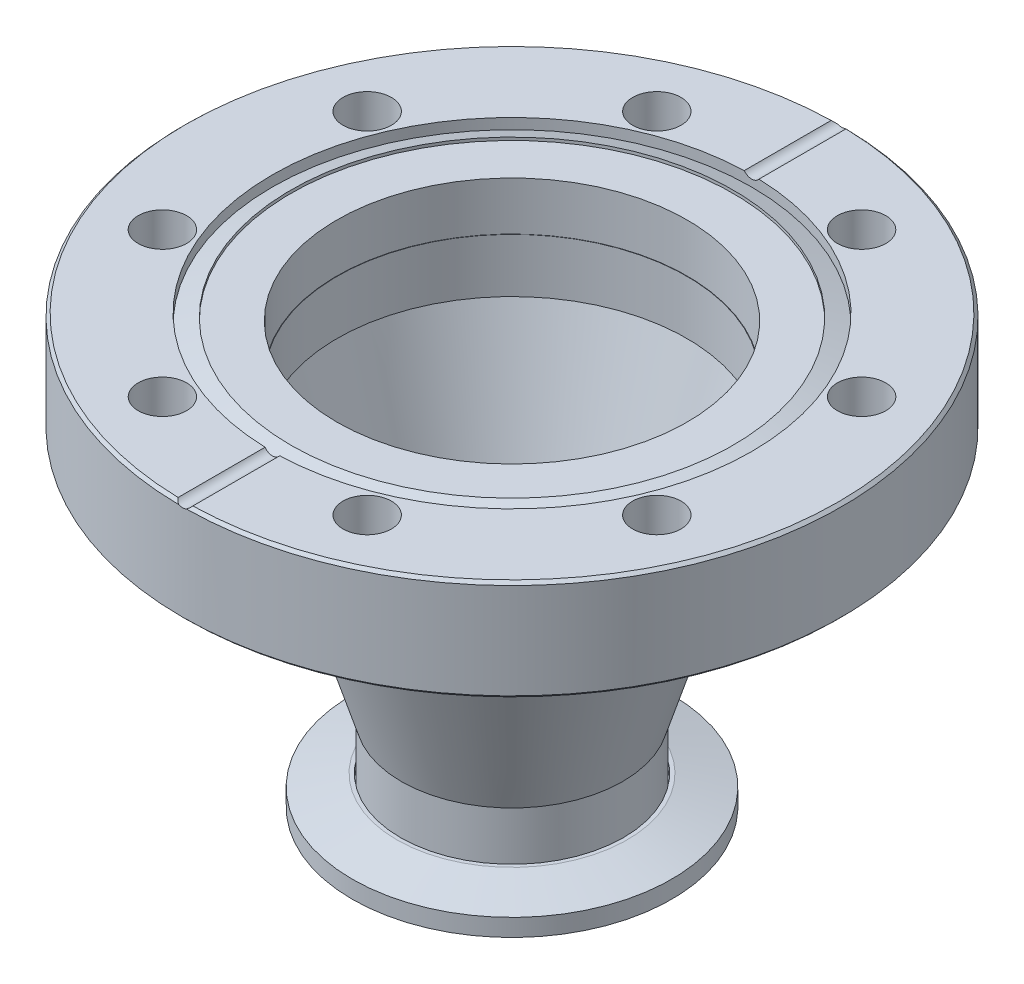
from build123d import *

# Parameters (mm, degrees)
SKETCH8_R               = 4.1671875
CUT_EXTRUDE1_DEPTH      = 109.928728451
CIRPATTERN1_COUNT       = 8
CUT_EXTRUDE2_DEPTH      = 89.295646449
CUT_EXTRUDE2_DEPTH_BACK = 89.295646449
SKETCH9_R               = 1.5875


with BuildPart() as part:
    # Sketch5 → Revolve1 (revolve)
    with BuildSketch(Plane(origin=(0, 0, 0), x_dir=(0, 0, -1), z_dir=(1, 0, 0)), mode=Mode.PRIVATE) as revolve1_sk:
        Polygon((20.5, -34.33), (20.5, -36.83), (27.5, -36.83), (27.5, -33.83), (19.849295844, -31.78), (19.2, -31.78), (19.2, -33.02), (18.3, -33.02), (18.3, -34.33), align=None)
    revolve(revolve1_sk.sketch.rotate(Axis((0, 36.83, 0), (0, -1, 0)), 180), axis=Axis((0, 36.83, 0), (0, -1, 0)))


with BuildPart() as body_2:
    # Sketch6 → Revolve2 (revolve)
    with BuildSketch(Plane(origin=(0, 0, 0), x_dir=(0, 0, -1), z_dir=(1, 0, 0)), mode=Mode.PRIVATE) as revolve2_sk:
        Polygon((17.399, -33.02), (17.399, -23.246743048), (30.099, 18.028256952), (30.099, 27.305), (31.75, 27.305), (31.75, 17.78), (19.05, -23.495), (19.05, -33.02), align=None)
    revolve(revolve2_sk.sketch.rotate(Axis((0, 36.83, 0), (0, -1, 0)), 180), axis=Axis((0, 36.83, 0), (0, -1, 0)))


with BuildPart() as body_3:
    # Sketch7 → Revolve3 (revolve)
    with BuildSketch(Plane(origin=(0, 0, 0), x_dir=(0, 0, -1), z_dir=(1, 0, 0)), mode=Mode.PRIVATE) as revolve3_sk:
        Polygon((31.75, 27.305), (31.75, 19.3802), (56.2436, 19.3802), (56.7436, 19.8802), (56.7436, 36.33), (56.2436, 36.83), (41.275, 36.83), (41.275, 35.004749662), (38.0746, 36.1696), (38.0746, 35.6616), (30.1625, 35.6616), (30.1625, 27.305), align=None)
    revolve(revolve3_sk.sketch.rotate(Axis((0, 36.83, 0), (0, -1, 0)), 180), axis=Axis((0, 36.83, 0), (0, -1, 0)))

    # Sketch8 → Cut-Extrude1 (cut, through all)
    with BuildSketch(Plane(origin=(0, 36.83, 0), x_dir=(1, 0, 0), z_dir=(0, 1, 0))):
        with Locations(Location((17.632139146, 42.56774946, 0), (0, 0, 270))):
            Circle(SKETCH8_R)
    cut_extrude1 = extrude(amount=-CUT_EXTRUDE1_DEPTH, mode=Mode.SUBTRACT)

    # CirPattern1: Cut-Extrude1 ×8 about axis
    cirpattern1_axis = Axis((0, 0, 0), (0, 1, 0))
    for i in range(1, CIRPATTERN1_COUNT):
        add(cut_extrude1.rotate(cirpattern1_axis, i * 360 / CIRPATTERN1_COUNT), mode=Mode.SUBTRACT)

    # Sketch9 → Cut-Extrude2 (cut, two sides: drawn at the far end of the back side and taken through both)
    with BuildSketch(Plane.XY.offset(-CUT_EXTRUDE2_DEPTH_BACK)):
        with Locations((0, 37.7825)):
            Circle(SKETCH9_R)
    extrude(amount=CUT_EXTRUDE2_DEPTH + CUT_EXTRUDE2_DEPTH_BACK, mode=Mode.SUBTRACT)


solid = Compound([part.part, body_2.part, body_3.part])
